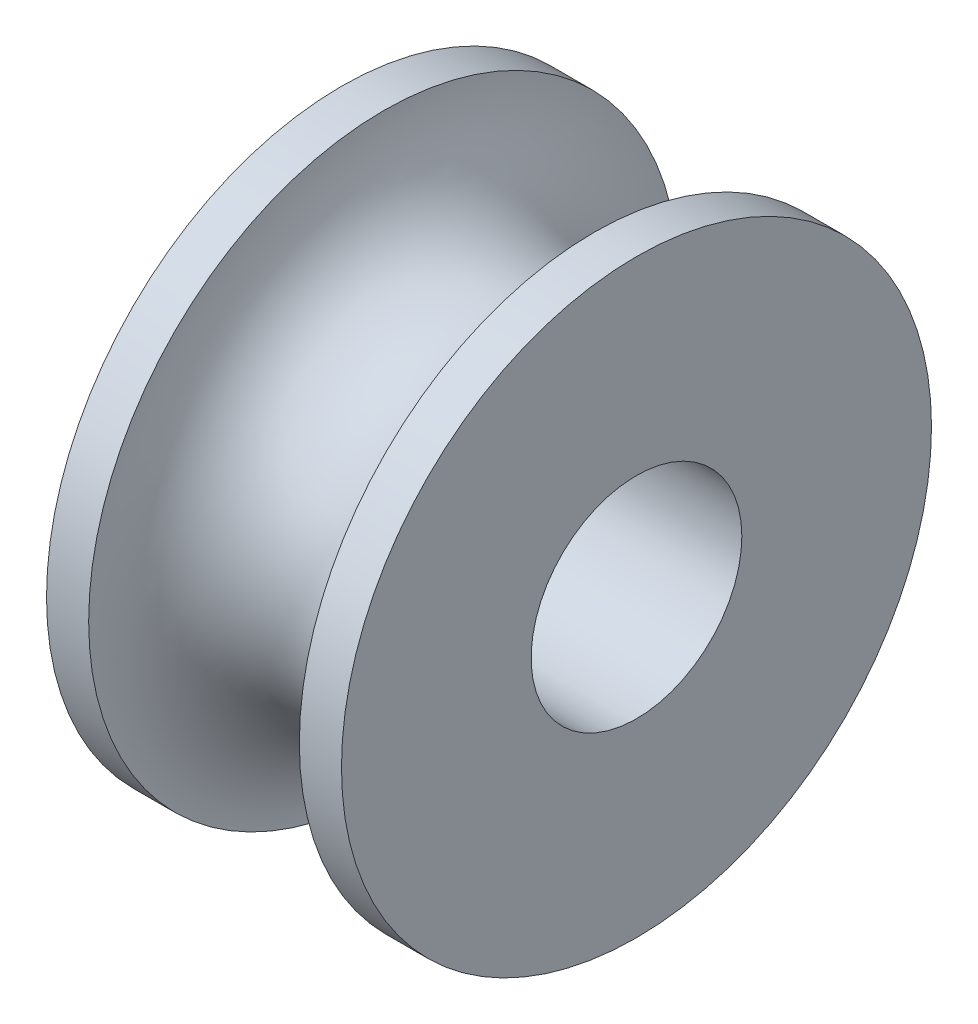
from build123d import *


with BuildPart() as part:
    # Sketch1 → Revolve1 (revolve)
    with BuildSketch(Plane.XY, mode=Mode.PRIVATE) as revolve1_sk:
        with BuildLine():
            Line((0, 2.5), (6.998866441, 2.5))
            Line((6.998866441, 2.5), (6.998866441, 7))
            Line((6.998866441, 7), (5.998866441, 7))
            ThreePointArc((5.998866441, 7), (3.499433221, 4.446768664), (1, 7))
            Line((1, 7), (0, 7))
            Line((0, 7), (0, 2.5))
        make_face()
    revolve(revolve1_sk.sketch.rotate(Axis((0, 0, 0), (-1, 0, 0)), 90), axis=Axis((0, 0, 0), (-1, 0, 0)))


solid = part.part
